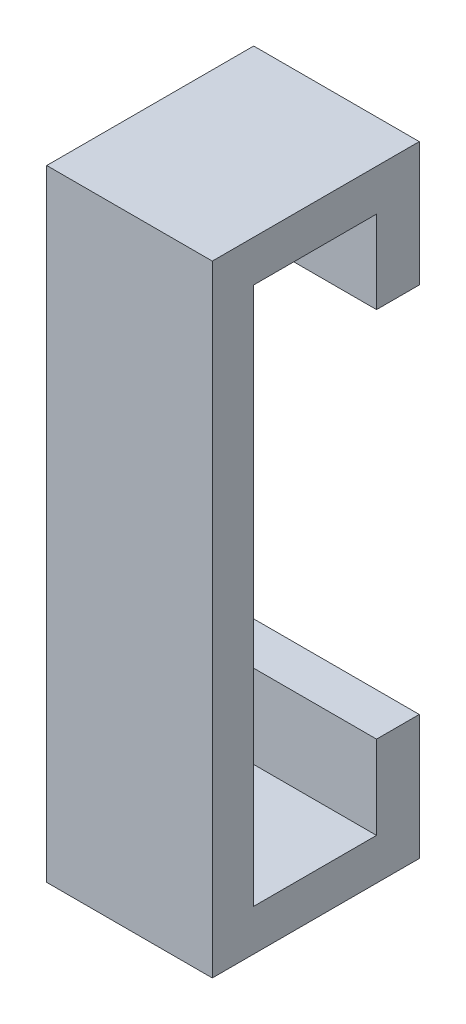
from build123d import *

# Parameters (mm, degrees)
SKETCH1_W           = 38.1
SKETCH1_H           = 12.7
BOSS_EXTRUDE1_DEPTH = 10.16
CUT_EXTRUDE1_DEPTH  = 10.16


with BuildPart() as part:
    # Sketch1 → Boss-Extrude1 (new body)
    with BuildSketch(Plane.YZ):
        with Locations((19.05, 6.35)):
            Rectangle(SKETCH1_W, SKETCH1_H)
    extrude(amount=BOSS_EXTRUDE1_DEPTH)

    # Sketch2 → Cut-Extrude1 (cut)
    with BuildSketch(Plane.YZ.offset(10.16)):
        Polygon((2.54, 10.16), (35.56, 10.16), (35.56, 2.621943929), (30.48, 2.621943929), (30.48, 0), (7.656390435, 0), (7.656390435, 2.621943929), (2.54, 2.621943929), align=None)
    extrude(amount=-CUT_EXTRUDE1_DEPTH, mode=Mode.SUBTRACT)


solid = part.part
